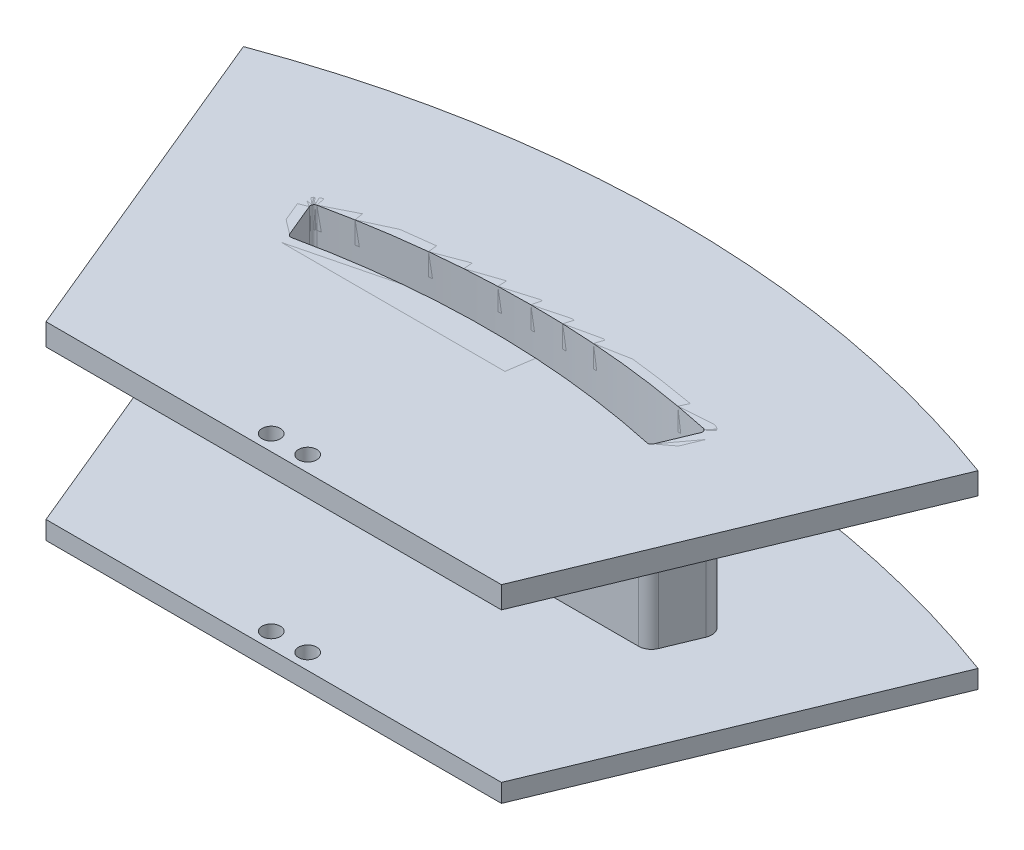
from build123d import *

# Parameters (mm, degrees)
SKETCH1_R           = 1.25
BOSS_EXTRUDE1_DEPTH = 2.5
BOSS_EXTRUDE2_START = -2.5
BOSS_EXTRUDE2_DEPTH = 26
BOSS_EXTRUDE3_START = 23.5
SKETCH1_4_R         = 1.25
BOSS_EXTRUDE3_DEPTH = 3


with BuildPart() as part:
    # Sketch1 → Boss-Extrude1 (new body)
    with BuildSketch(Plane(origin=(0, 0, 0), x_dir=(1, 0, 0), z_dir=(0, 1, 0))):
        with BuildLine():
            Line((-50.40491586, 135.957141986), (-31.25, 89.71308433))
            Line((-31.25, 89.71308433), (31.25, 89.71308433))
            Line((31.25, 89.71308433), (50.40491586, 135.957141986))
            ThreePointArc((50.40491586, 135.957141986), (0, 145), (-50.40491586, 135.957141986))
        make_face()
        with Locations(Location((-2.5, 91.868329805, 0), (0, 0, 270))):
            Circle(SKETCH1_R, mode=Mode.SUBTRACT)
        with Locations(Location((2.5, 91.868329805, 0), (0, 0, 270))):
            Circle(SKETCH1_R, mode=Mode.SUBTRACT)
        with BuildLine():
            Line((-26.870747539, 121.475518488), (-24.957330377, 116.856120826))
            ThreePointArc((-24.957330377, 116.856120826), (-24.727253788, 116.604473302), (-24.389349959, 116.558836529))
            ThreePointArc((-24.389349959, 116.558836529), (0, 119.174853647), (24.389349959, 116.558836529))
            ThreePointArc((24.389349959, 116.558836529), (24.727253788, 116.604473302), (24.957330377, 116.856120826))
            Line((24.957330377, 116.856120826), (26.870747539, 121.475518488))
            ThreePointArc((26.870747539, 121.475518488), (26.851801477, 121.898714852), (26.514867242, 122.155482133))
            ThreePointArc((26.514867242, 122.155482133), (0, 125), (-26.514867242, 122.155482133))
            ThreePointArc((-26.514867242, 122.155482133), (-26.851801477, 121.898714852), (-26.870747539, 121.475518488))
        make_face(mode=Mode.SUBTRACT)
    extrude(amount=-BOSS_EXTRUDE1_DEPTH)


with BuildPart() as body_2:
    # Sketch1<3> → Boss-Extrude2 (new body)
    with BuildSketch(Plane(origin=(0, 0, 0), x_dir=(1, 0, 0), z_dir=(0, 1, 0)).offset(BOSS_EXTRUDE2_START)):
        with BuildLine():
            Line((-28.025596955, 120.997164198), (-26.112179793, 116.377766535))
            ThreePointArc((-26.112179793, 116.377766535), (-25.467638519, 115.59239072), (-24.495390611, 115.297462542))
            Line((-24.495390611, 115.297462542), (24.495390611, 115.297462542))
            ThreePointArc((24.495390611, 115.297462542), (25.467638519, 115.59239072), (26.112179793, 116.377766535))
            Line((26.112179793, 116.377766535), (28.025596955, 120.997164198))
            ThreePointArc((28.025596955, 120.997164198), (27.959285739, 122.478351471), (26.780015914, 123.377036954))
            ThreePointArc((26.780015914, 123.377036954), (0, 126.25), (-26.780015914, 123.377036954))
            ThreePointArc((-26.780015914, 123.377036954), (-27.959285739, 122.478351471), (-28.025596955, 120.997164198))
        make_face()
        with BuildLine():
            Line((-26.870747539, 121.475518488), (-24.957330377, 116.856120826))
            ThreePointArc((-24.957330377, 116.856120826), (-24.727253788, 116.604473302), (-24.389349959, 116.558836529))
            ThreePointArc((-24.389349959, 116.558836529), (0, 119.174853647), (24.389349959, 116.558836529))
            ThreePointArc((24.389349959, 116.558836529), (24.727253788, 116.604473302), (24.957330377, 116.856120826))
            Line((24.957330377, 116.856120826), (26.870747539, 121.475518488))
            ThreePointArc((26.870747539, 121.475518488), (26.851801477, 121.898714852), (26.514867242, 122.155482133))
            ThreePointArc((26.514867242, 122.155482133), (0, 125), (-26.514867242, 122.155482133))
            ThreePointArc((-26.514867242, 122.155482133), (-26.851801477, 121.898714852), (-26.870747539, 121.475518488))
        make_face(mode=Mode.SUBTRACT)
    extrude(amount=BOSS_EXTRUDE2_DEPTH)


with BuildPart() as body_3:
    # Sketch1<4> → Boss-Extrude3 (new body)
    # profile 1 of 2: a face of its own
    with BuildSketch(Plane(origin=(0, 0, 0), x_dir=(1, 0, 0), z_dir=(0, 1, 0)).offset(BOSS_EXTRUDE3_START)):
        with BuildLine():
            ThreePointArc((-50.40491586, 135.957141986), (0, 145), (50.40491586, 135.957141986))
            Line((50.40491586, 135.957141986), (31.25, 89.71308433))
            Line((31.25, 89.71308433), (-31.25, 89.71308433))
            Line((-31.25, 89.71308433), (-50.40491586, 135.957141986))
        make_face()
        with Locations(Location((2.5, 91.868329805, 0), (0, 0, 90))):
            Circle(SKETCH1_4_R, mode=Mode.SUBTRACT)
        with Locations(Location((-2.5, 91.868329805, 0), (0, 0, 90))):
            Circle(SKETCH1_4_R, mode=Mode.SUBTRACT)
        with BuildLine():
            Line((-28.025596955, 120.997164198), (-26.112179793, 116.377766535))
            ThreePointArc((-26.112179793, 116.377766535), (-25.467638519, 115.59239072), (-24.495390611, 115.297462542))
            Line((-24.495390611, 115.297462542), (24.495390611, 115.297462542))
            ThreePointArc((24.495390611, 115.297462542), (25.467638519, 115.59239072), (26.112179793, 116.377766535))
            Line((26.112179793, 116.377766535), (28.025596955, 120.997164198))
            ThreePointArc((28.025596955, 120.997164198), (27.959285739, 122.478351471), (26.780015914, 123.377036954))
            ThreePointArc((26.780015914, 123.377036954), (0, 126.25), (-26.780015914, 123.377036954))
            ThreePointArc((-26.780015914, 123.377036954), (-27.959285739, 122.478351471), (-28.025596955, 120.997164198))
        make_face(mode=Mode.SUBTRACT)
    # profile 2 of 2: a face of its own
    with BuildSketch(Plane(origin=(0, 0, 0), x_dir=(1, 0, 0), z_dir=(0, 1, 0)).offset(BOSS_EXTRUDE3_START)):
        with BuildLine():
            ThreePointArc((-28.025596955, 120.997164198), (-27.959285739, 122.478351471), (-26.780015914, 123.377036954))
            ThreePointArc((-26.780015914, 123.377036954), (0, 126.25), (26.780015914, 123.377036954))
            ThreePointArc((26.780015914, 123.377036954), (27.959285739, 122.478351471), (28.025596955, 120.997164198))
            Line((28.025596955, 120.997164198), (26.112179793, 116.377766535))
            ThreePointArc((26.112179793, 116.377766535), (25.467638519, 115.59239072), (24.495390611, 115.297462542))
            Line((24.495390611, 115.297462542), (-24.495390611, 115.297462542))
            ThreePointArc((-24.495390611, 115.297462542), (-25.467638519, 115.59239072), (-26.112179793, 116.377766535))
            Line((-26.112179793, 116.377766535), (-28.025596955, 120.997164198))
        make_face()
        with BuildLine():
            Line((26.870747539, 121.475518488), (24.957330377, 116.856120826))
            ThreePointArc((24.957330377, 116.856120826), (24.727253788, 116.604473302), (24.389349959, 116.558836529))
            ThreePointArc((24.389349959, 116.558836529), (0, 119.174853647), (-24.389349959, 116.558836529))
            ThreePointArc((-24.389349959, 116.558836529), (-24.727253788, 116.604473302), (-24.957330377, 116.856120826))
            Line((-24.957330377, 116.856120826), (-26.870747539, 121.475518488))
            ThreePointArc((-26.870747539, 121.475518488), (-26.851801477, 121.898714852), (-26.514867242, 122.155482133))
            ThreePointArc((-26.514867242, 122.155482133), (0, 125), (26.514867242, 122.155482133))
            ThreePointArc((26.514867242, 122.155482133), (26.851801477, 121.898714852), (26.870747539, 121.475518488))
        make_face(mode=Mode.SUBTRACT)
    extrude(amount=-BOSS_EXTRUDE3_DEPTH)


solid = Compound([part.part, body_2.part, body_3.part])
